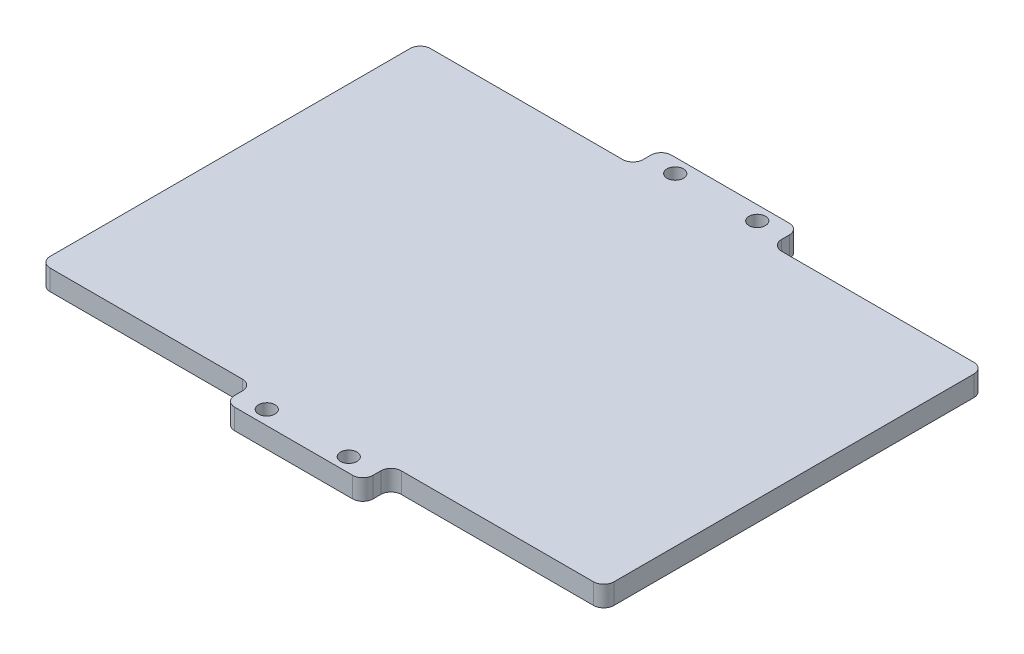
from build123d import *

# Parameters (mm, degrees)
SKETCH_1_W          = 110
SKETCH_1_H          = 85.2
EXTRUDE_1_DEPTH     = 4
SKETCH_2_W          = 83
SKETCH_2_H          = 11
CUT_EXTRUDE_1_DEPTH = 4
SKETCH_3_R          = 1.6
CUT_EXTRUDE_2_DEPTH = 4
FILLET_1_R          = 2


with BuildPart() as part:
    # 草图1 → 凸台-拉伸1 (new body)
    with BuildSketch(Plane(origin=(0, 0, 0), x_dir=(1, 0, 0), z_dir=(0, 1, 0))):
        Rectangle(SKETCH_1_W, SKETCH_1_H)
    extrude(amount=EXTRUDE_1_DEPTH)

    # 草图2 → 切除-拉伸1 (cut)
    with BuildSketch(Plane(origin=(0, 4, 0), x_dir=(1, 0, 0), z_dir=(0, 1, 0))):
        with Locations((-55, -42.6)):
            Rectangle(SKETCH_2_W, SKETCH_2_H)
        with Locations((55, -42.6)):
            Rectangle(SKETCH_2_W, SKETCH_2_H)
        with Locations((55, 42.6)):
            Rectangle(SKETCH_2_W, SKETCH_2_H)
        with Locations((-55, 42.6)):
            Rectangle(SKETCH_2_W, SKETCH_2_H)
    extrude(amount=-CUT_EXTRUDE_1_DEPTH, mode=Mode.SUBTRACT)

    # 草图3 → 切除-拉伸2 (cut)
    with BuildSketch(Plane(origin=(0, 4, 0), x_dir=(1, 0, 0), z_dir=(0, 1, 0))):
        with Locations(Location((-8, -39.85, 0), (0, 0, 270))):
            Circle(SKETCH_3_R)
        with Locations(Location((8, -39.85, 0), (0, 0, 90))):
            Circle(SKETCH_3_R)
        with Locations(Location((8, 39.85, 0), (0, 0, 270))):
            Circle(SKETCH_3_R)
        with Locations(Location((-8, 39.85, 0), (0, 0, 90))):
            Circle(SKETCH_3_R)
    extrude(amount=-CUT_EXTRUDE_2_DEPTH, mode=Mode.SUBTRACT)

    # 圆角1
    fillet_1_edges = [part.edges().sort_by_distance(p)[0] for p in [
        (-13.5, 2, 42.6),
        (-13.5, 2, 37.1),
        (-55, 2, 37.1),
        (13.5, 2, 42.6),
        (55, 2, 37.1),
        (13.5, 2, 37.1),
        (55, 2, -37.1),
        (13.5, 2, -42.6),
        (13.5, 2, -37.1),
        (-13.5, 2, -42.6),
        (-55, 2, -37.1),
        (-13.5, 2, -37.1),
    ]]
    fillet(fillet_1_edges, radius=FILLET_1_R)


solid = part.part
